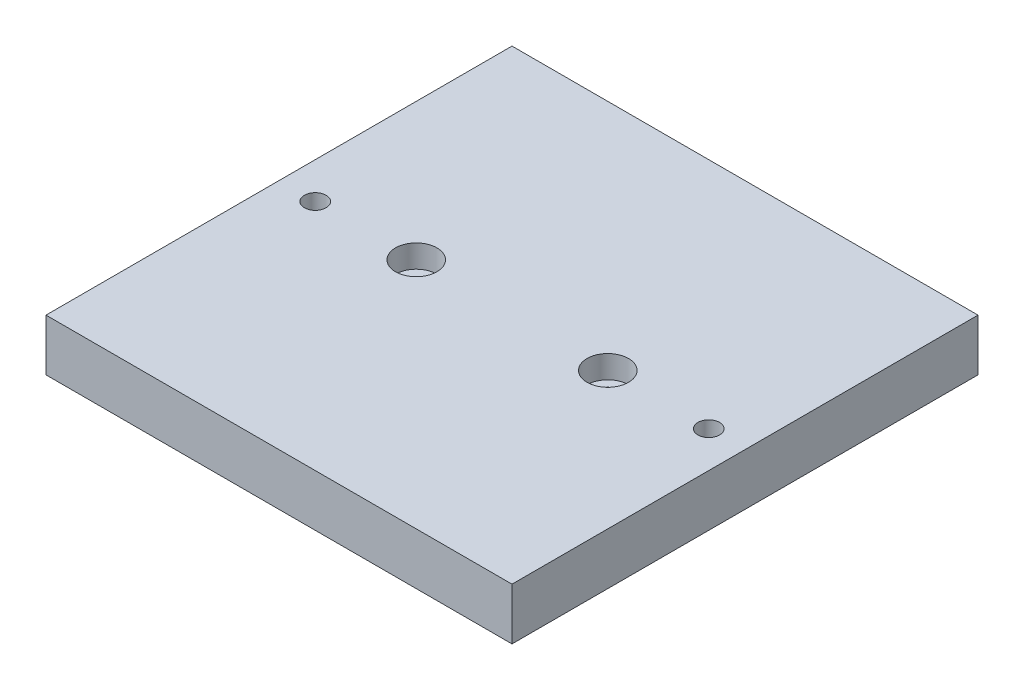
from build123d import *

# Parameters (mm, degrees)
SKETCH1_W               = 90
SKETCH1_H               = 90
BOSS_EXTRUDE1_DEPTH     = 10
CUT_EXTRUDE1_DEPTH      = 95
CUT_EXTRUDE1_DEPTH_BACK = 74
SKETCH2_R               = 2.25
SKETCH2_3_R             = 4
SKETCH2_3_R_2           = 2.25
CUT_EXTRUDE2_DEPTH      = 4.4
M5_TAPPED_HOLE1_D       = 4.2


with BuildPart() as part:
    # Sketch1 → Boss-Extrude1 (new body)
    with BuildSketch(Plane(origin=(0, 0, 0), x_dir=(1, 0, 0), z_dir=(0, 1, 0))):
        with Locations((-60.460122699, -8.144171779)):
            Rectangle(SKETCH1_W, SKETCH1_H)
    extrude(amount=BOSS_EXTRUDE1_DEPTH)

    # Sketch2 → Cut-Extrude1 (cut, two sides: drawn at the far end of the back side and taken through both)
    with BuildSketch(Plane(origin=(0, 10, 0), x_dir=(1, 0, 0), z_dir=(0, 1, 0)).offset(-CUT_EXTRUDE1_DEPTH_BACK)):
        with Locations((-78.960122699, -8.144171779)):
            Circle(SKETCH2_R)
        with Locations((-41.960122699, -8.144171779)):
            Circle(SKETCH2_R)
    extrude(amount=CUT_EXTRUDE1_DEPTH + CUT_EXTRUDE1_DEPTH_BACK, mode=Mode.SUBTRACT)

    # Sketch2<3> → Cut-Extrude2 (cut)
    # profile 1 of 2: a face of its own
    with BuildSketch(Plane(origin=(0, 10, 0), x_dir=(1, 0, 0), z_dir=(0, 1, 0))):
        with Locations((-78.960122699, -8.144171779)):
            Circle(SKETCH2_3_R)
        with Locations((-78.960122699, -8.144171779)):
            Circle(SKETCH2_3_R_2, mode=Mode.SUBTRACT)
    # profile 2 of 2: a face of its own
    with BuildSketch(Plane(origin=(0, 10, 0), x_dir=(1, 0, 0), z_dir=(0, 1, 0))):
        with Locations((-41.960122699, -8.144171779)):
            Circle(SKETCH2_3_R)
        with Locations((-41.960122699, -8.144171779)):
            Circle(SKETCH2_3_R_2, mode=Mode.SUBTRACT)
    extrude(amount=-CUT_EXTRUDE2_DEPTH, mode=Mode.SUBTRACT)

    # M5 Tapped Hole1 (through all)
    with Locations(Plane(origin=(0, 10, 0), x_dir=(1, 0, 0), z_dir=(0, 1, 0))):
        with Locations((-98.460122699, -8.144171779), (-22.460122699, -8.144171779)):
            Hole(M5_TAPPED_HOLE1_D / 2)


solid = part.part
